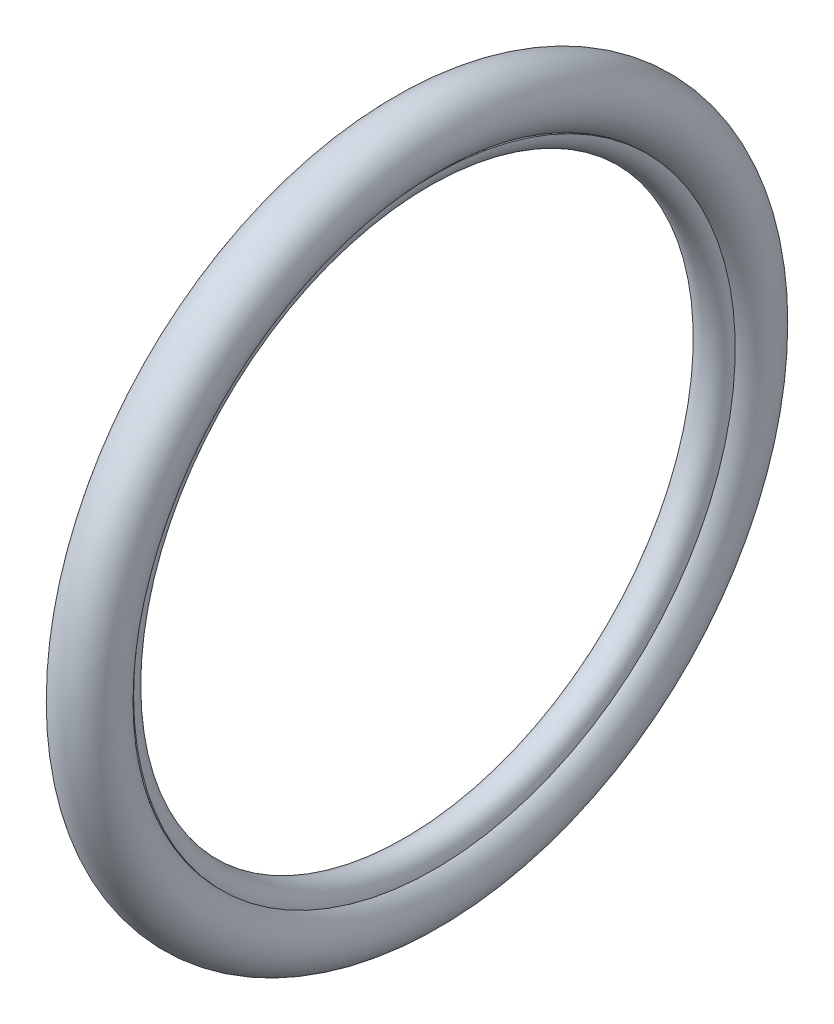
from build123d import *

# Parameters (mm, degrees)
SKETCH3_R = 31.75


with BuildPart() as part:
    # Sketch2 → Revolve1 (revolve)
    with BuildSketch(Plane.XY):
        with BuildLine():
            Line((-18, 311), (-16, 311))
            ThreePointArc((-16, 311), (0, 295), (16, 311))
            Line((16, 311), (18, 311))
            ThreePointArc((18, 311), (0, 293), (-18, 311))
        make_face()
    revolve(axis=Axis((-74, 0, 0), (1, 0, 0)))


with BuildPart() as body_2:
    # Sketch3 → Revolve2 (revolve)
    with BuildSketch(Plane.XY):
        with Locations((0, 338.423757948)):
            Circle(SKETCH3_R)
    revolve(axis=Axis((-71, 0, 0), (1, 0, 0)))


solid = Compound([part.part, body_2.part])
